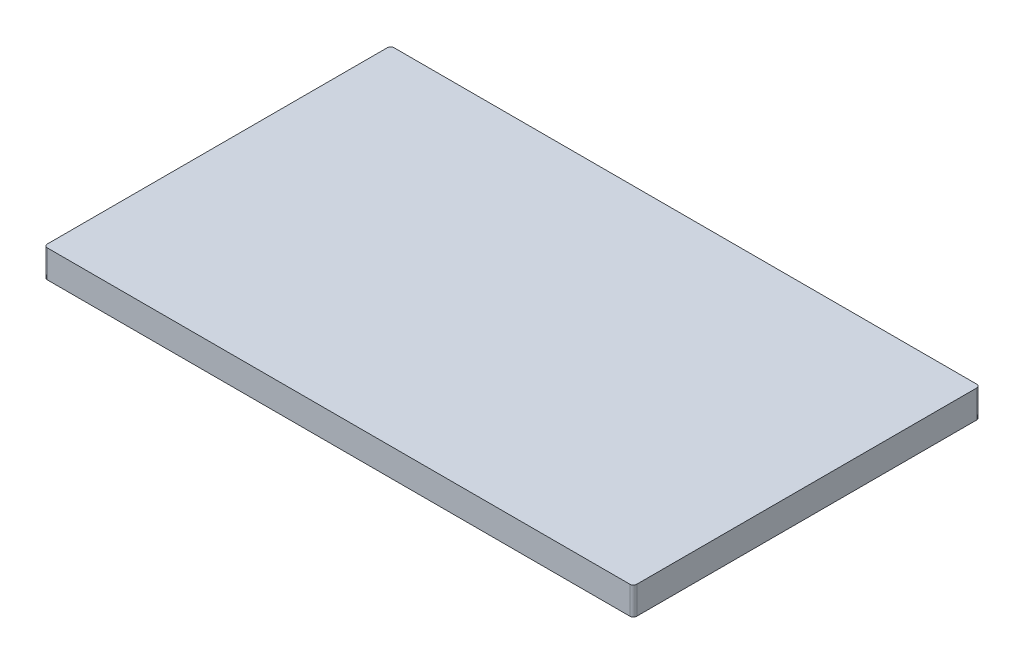
from build123d import *

# Parameters (mm, degrees)
SKETCH_1_W      = 170
SKETCH_1_H      = 100
EXTRUDE_1_DEPTH = 8
FILLET_1_R      = 1


with BuildPart() as part:
    # 草图1 → 凸台-拉伸1 (new body)
    with BuildSketch(Plane(origin=(0, 0, 0), x_dir=(1, 0, 0), z_dir=(0, 1, 0))):
        with Locations((85, 50)):
            Rectangle(SKETCH_1_W, SKETCH_1_H)
    extrude(amount=EXTRUDE_1_DEPTH)

    # 圆角1
    fillet_1_edges = [part.edges().sort_by_distance(p)[0] for p in [
        (0, 4, -100),
        (170, 4, -100),
        (170, 4, 0),
        (0, 4, 0),
    ]]
    fillet(fillet_1_edges, radius=FILLET_1_R)


solid = part.part
